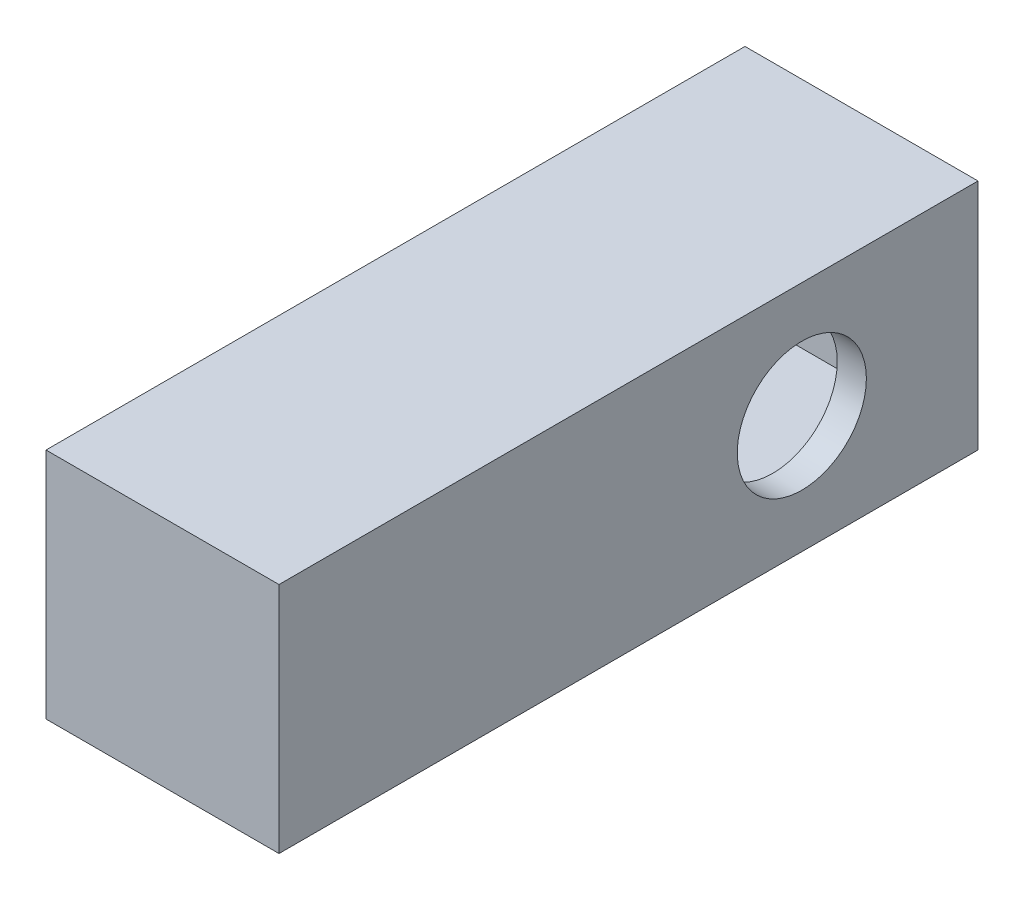
from build123d import *

# Parameters (mm, degrees)
SKETCH1_W           = 50.8
SKETCH1_H           = 152.4
BOSS_EXTRUDE1_DEPTH = 50.8
SHELL1_T            = -6.35
SKETCH4_R           = 14.075
CUT_EXTRUDE1_DEPTH  = 25


with BuildPart() as part:
    # Sketch1 → Boss-Extrude1 (new body)
    with BuildSketch(Plane(origin=(0, 0, 0), x_dir=(1, 0, 0), z_dir=(0, 1, 0))):
        with Locations((25.4, 76.2)):
            Rectangle(SKETCH1_W, SKETCH1_H)
    extrude(amount=BOSS_EXTRUDE1_DEPTH)

    # Shell1
    shell1_openings = [part.faces().sort_by_distance(p)[0] for p in [
        (0, 25.4, -76.2),
    ]]
    offset(amount=SHELL1_T, openings=shell1_openings, kind=Kind.INTERSECTION)

    # Sketch4 → Cut-Extrude1 (cut)
    with BuildSketch(Plane(origin=(50.8, 0, 0), x_dir=(0, 0, -1), z_dir=(1, 0, 0))):
        with Locations((113.988045791, 25.683455189)):
            Circle(SKETCH4_R)
    extrude(amount=-CUT_EXTRUDE1_DEPTH, mode=Mode.SUBTRACT)


solid = part.part
